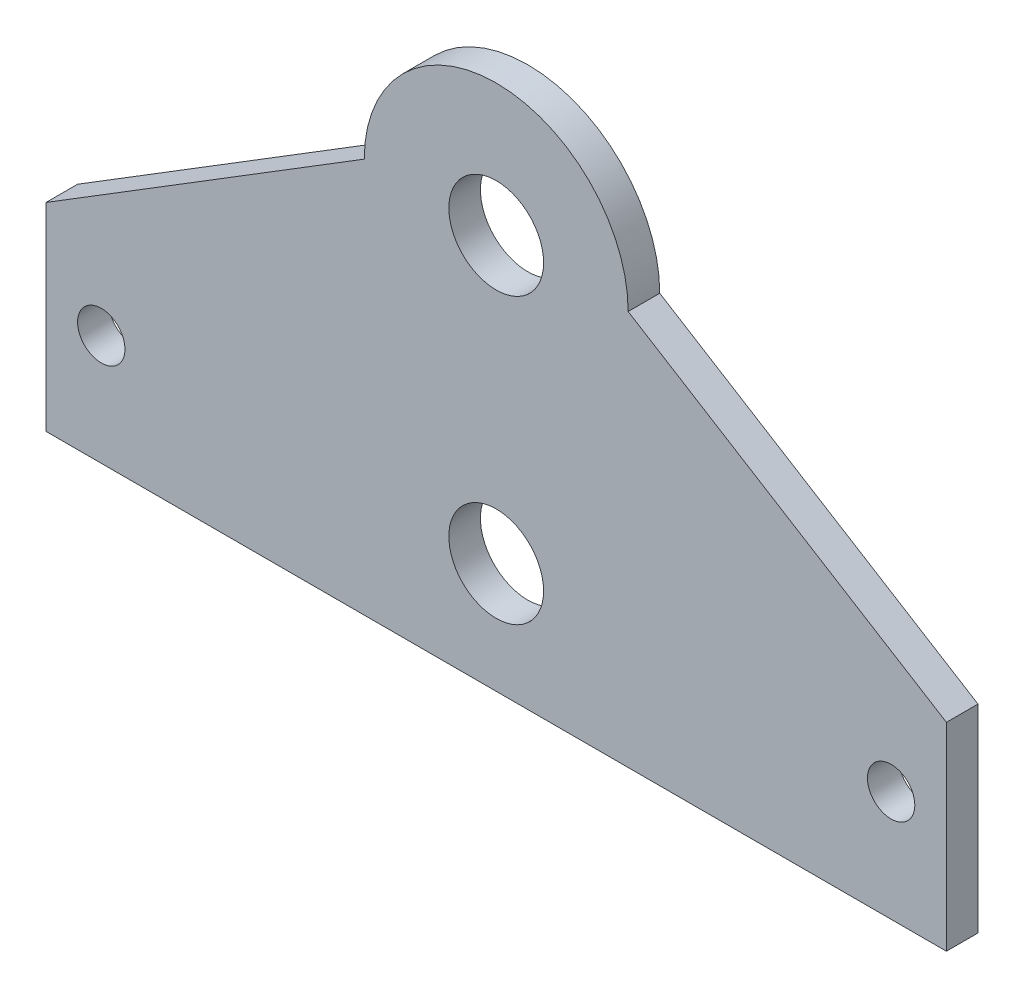
from build123d import *

# Parameters (mm, degrees)
SKETCH_1_R      = 3
SKETCH_1_R_2    = 1.5
EXTRUDE_1_DEPTH = 2


with BuildPart() as part:
    # 草图1 → 凸台-拉伸1 (new body)
    with BuildSketch(Plane.XY):
        with BuildLine():
            Line((23.59477523, -43.872599913), (43.741142958, -56.320462917))
            Line((43.741142958, -56.320462917), (43.741142958, -68.872599913))
            Line((43.741142958, -68.872599913), (15.241142958, -68.872599913))
            Line((15.241142958, -68.872599913), (-13.258857042, -68.872599913))
            Line((-13.258857042, -68.872599913), (-13.258857042, -56.320462917))
            Line((-13.258857042, -56.320462917), (6.887510685, -43.872599913))
            ThreePointArc((6.887510685, -43.872599913), (15.241142958, -35.51896764), (23.59477523, -43.872599913))
        make_face()
        with Locations((15.241142958, -61.872599913)):
            Circle(SKETCH_1_R, mode=Mode.SUBTRACT)
        with Locations((40.241142958, -61.872599913)):
            Circle(SKETCH_1_R_2, mode=Mode.SUBTRACT)
        with Locations(Location((-9.758857042, -61.872599913, 0), (0, 0, 180))):
            Circle(SKETCH_1_R_2, mode=Mode.SUBTRACT)
        with Locations((15.241142958, -43.872599913)):
            Circle(SKETCH_1_R, mode=Mode.SUBTRACT)
    extrude(amount=EXTRUDE_1_DEPTH)


solid = part.part
